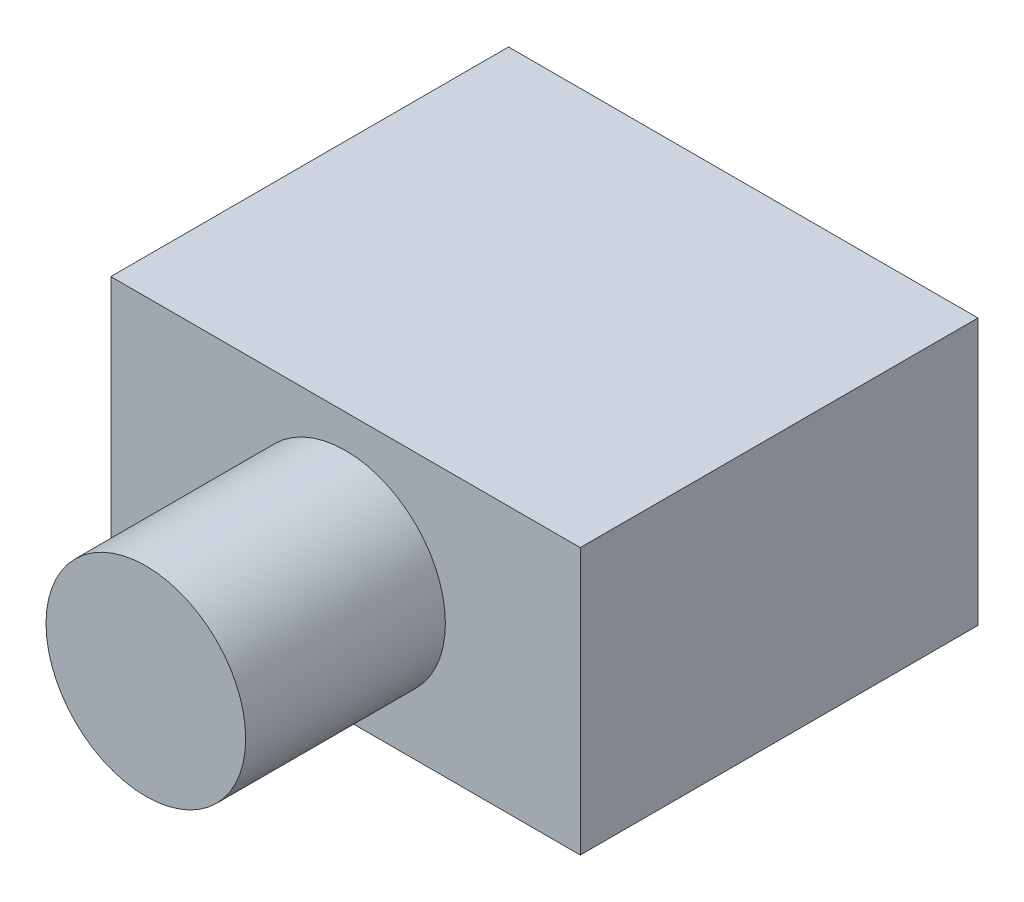
from build123d import *

# Parameters (mm, degrees)
ESQUISSE1_W        = 28.21
ESQUISSE1_H        = 16
BOSS_EXTRU_1_DEPTH = 23.9
ESQUISSE2_R        = 6
BOSS_EXTRU_2_DEPTH = 12


with BuildPart() as part:
    # Esquisse1 → Boss.-Extru.1 (new body)
    with BuildSketch(Plane.XY):
        Rectangle(ESQUISSE1_W, ESQUISSE1_H)
    extrude(amount=BOSS_EXTRU_1_DEPTH)

    # Esquisse2 → Boss.-Extru.2 (add)
    with BuildSketch(Plane.XY.offset(23.9)):
        Circle(ESQUISSE2_R)
    extrude(amount=BOSS_EXTRU_2_DEPTH)


solid = part.part
